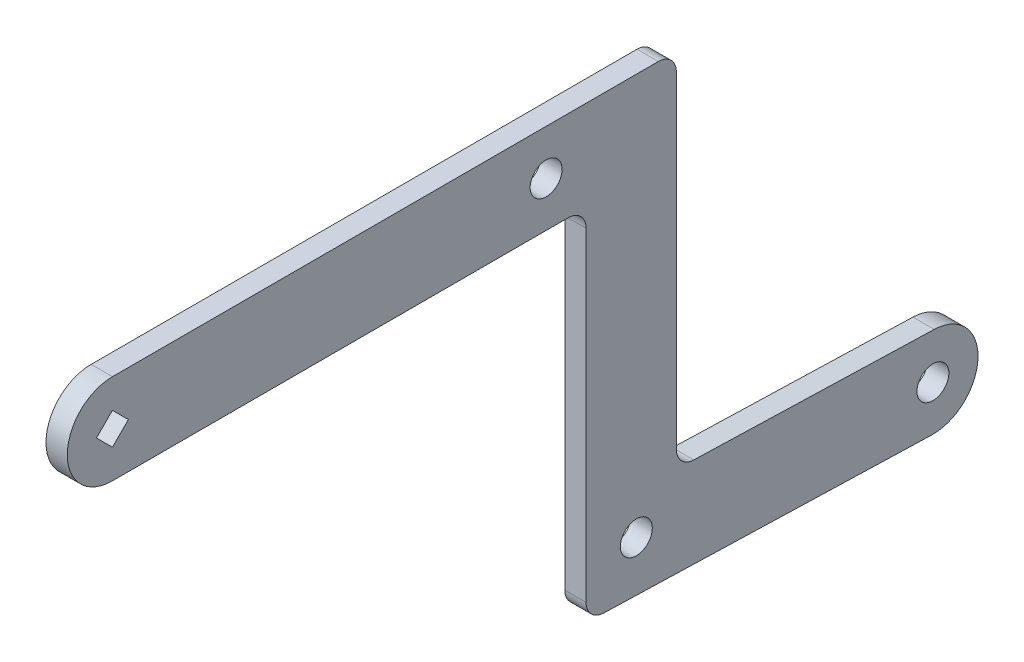
from build123d import *

# Parameters (mm, degrees)
SKETCH1_R               = 2.24506403
BOSS_EXTRUDE1_DEPTH     = 3
FILLET1_R               = 2.54
SKETCH2_R               = 2.2479
TORQUE_PREVENTION_DEPTH = 136.15202741


with BuildPart() as part:
    # Sketch1 → Boss-Extrude1 (new body)
    with BuildSketch(Plane(origin=(0, 0, 0), x_dir=(0, 0, -1), z_dir=(1, 0, 0))):
        with BuildLine():
            Line((0, -6.35), (66.675, -6.35))
            Line((66.675, -6.35), (66.675, -56.962915387))
            Line((66.675, -56.962915387), (115.296830482, -58.417161651))
            ThreePointArc((115.296830482, -58.417161651), (121.833831472, -52.259839338), (115.676509159, -45.722838349))
            Line((115.676509159, -45.722838349), (79.375, -44.637084613))
            Line((79.375, -44.637084613), (79.375, 6.35))
            Line((79.375, 6.35), (0, 6.35))
            ThreePointArc((0, 6.35), (-6.35, 0), (0, -6.35))
        make_face()
        with Locations((115.486669821, -52.07)):
            Circle(SKETCH1_R, mode=Mode.SUBTRACT)
        Polygon((0, 2.24506403), (2.24506403, 0), (0, -2.24506403), (-2.24506403, 0), align=None, mode=Mode.SUBTRACT)
    extrude(amount=BOSS_EXTRUDE1_DEPTH)

    # Fillet1
    fillet1_edges = [part.edges().sort_by_distance(p)[0] for p in [
        (1.5, 6.35, -79.375),
        (1.5, -44.637084613, -79.375),
        (1.5, -56.962915387, -66.675),
        (1.5, -6.35, -66.675),
    ]]
    fillet(fillet1_edges, radius=FILLET1_R)

    # Sketch2 → Torque prevention (cut, through all)
    with BuildSketch(Plane(origin=(3, 0, 0), x_dir=(0, 0, -1), z_dir=(1, 0, 0))):
        with Locations((73.742299151, -50.103834019)):
            Circle(SKETCH2_R)
        with Locations((61.042299151, 0)):
            Circle(SKETCH2_R)
    extrude(amount=-TORQUE_PREVENTION_DEPTH, mode=Mode.SUBTRACT)


solid = part.part
